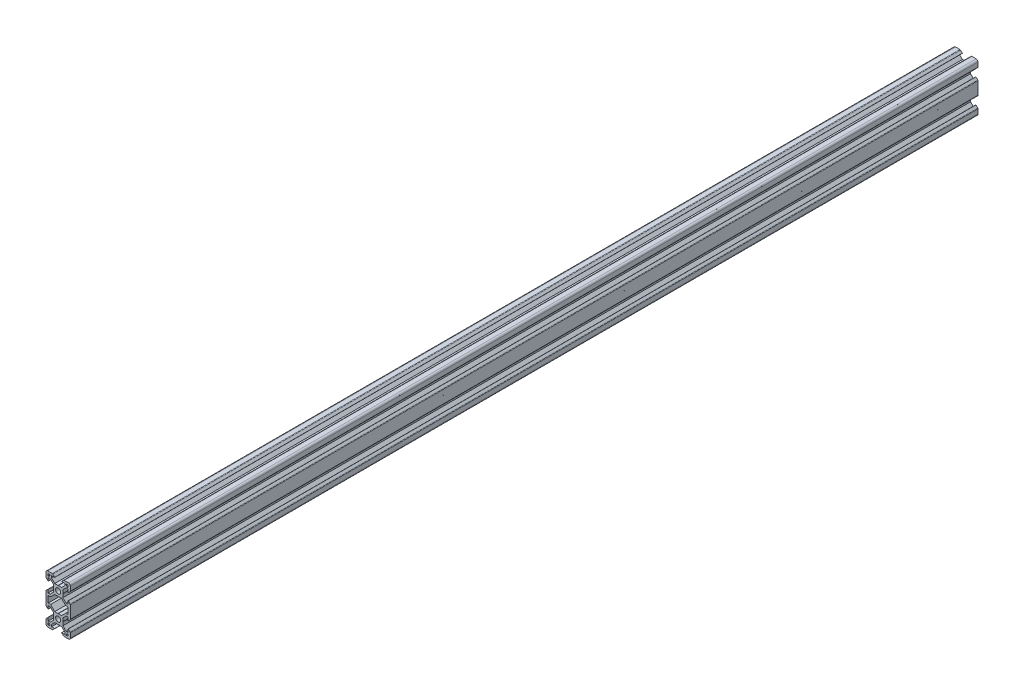
from build123d import *

# Parameters (mm, degrees)
SKETCH2_R           = 2.1
BOSS_EXTRUDE1_DEPTH = 746


with BuildPart() as part:
    # Sketch2 → Boss-Extrude1 (new body)
    with BuildSketch(Plane.XY):
        with BuildLine():
            Line((-0.1, 3.9), (0, 3.8))
            Line((0, 3.8), (0.1, 3.9))
            Line((0.1, 3.9), (2.840365134, 3.9))
            Line((2.840365134, 3.9), (5.5, 6.558825842))
            Line((5.5, 6.558825842), (5.5, 8.197505675))
            Line((5.5, 8.197505675), (2.89, 8.197505675))
            Line((2.89, 8.197505675), (2.89, 8.307505675))
            Line((2.89, 8.307505675), (4.348614357, 9.766120032))
            ThreePointArc((4.348614357, 9.766120032), (4.604908803, 9.937370505), (4.907228714, 9.997505675))
            Line((4.907228714, 9.997505675), (8.5, 9.997505675))
            ThreePointArc((8.5, 9.997505675), (9.560660172, 9.558165846), (10, 8.497505675))
            Line((10, 8.497505675), (10, 4.904734389))
            ThreePointArc((10, 4.904734389), (9.939864831, 4.602414477), (9.768614357, 4.346120032))
            Line((9.768614357, 4.346120032), (8.31, 2.887505675))
            Line((8.31, 2.887505675), (8.2, 2.887505675))
            Line((8.2, 2.887505675), (8.2, 5.497505675))
            Line((8.2, 5.497505675), (6.56, 5.497505675))
            Line((6.56, 5.497505675), (3.9, 2.83831481))
            Line((3.9, 2.83831481), (3.9, 0.1))
            Line((3.9, 0.1), (3.8, 0))
            Line((3.8, 0), (3.9, -0.1))
            Line((3.9, -0.1), (3.9, -2.84))
            Line((3.9, -2.84), (6.56, -5.5))
            Line((6.56, -5.5), (8.2, -5.5))
            Line((8.2, -5.5), (8.2, -2.89))
            Line((8.2, -2.89), (8.31, -2.89))
            Line((8.31, -2.89), (9.765685425, -4.345685425))
            ThreePointArc((9.765685425, -4.345685425), (9.939103626, -4.605224104), (10, -4.91137085))
            Line((10, -4.91137085), (10, -15.08862915))
            ThreePointArc((10, -15.08862915), (9.939103626, -15.394775896), (9.765685425, -15.654314575))
            Line((9.765685425, -15.654314575), (8.31, -17.11))
            Line((8.31, -17.11), (8.2, -17.11))
            Line((8.2, -17.11), (8.2, -14.5))
            Line((8.2, -14.5), (6.56, -14.5))
            Line((6.56, -14.5), (3.9, -17.16))
            Line((3.9, -17.16), (3.9, -19.9))
            Line((3.9, -19.9), (3.8, -20))
            Line((3.8, -20), (3.9, -20.1))
            Line((3.9, -20.1), (3.9, -22.83831481))
            Line((3.9, -22.83831481), (6.56, -25.497505675))
            Line((6.56, -25.497505675), (8.2, -25.497505675))
            Line((8.2, -25.497505675), (8.2, -22.887505675))
            Line((8.2, -22.887505675), (8.31, -22.887505675))
            Line((8.31, -22.887505675), (9.768614357, -24.346120032))
            ThreePointArc((9.768614357, -24.346120032), (9.939864831, -24.602414477), (10, -24.904734389))
            Line((10, -24.904734389), (10, -28.497505675))
            ThreePointArc((10, -28.497505675), (9.560660172, -29.558165846), (8.5, -29.997505675))
            Line((8.5, -29.997505675), (4.907228714, -29.997505675))
            ThreePointArc((4.907228714, -29.997505675), (4.604908803, -29.937370505), (4.348614357, -29.766120032))
            Line((4.348614357, -29.766120032), (2.89, -28.307505675))
            Line((2.89, -28.307505675), (2.89, -28.197505675))
            Line((2.89, -28.197505675), (5.5, -28.197505675))
            Line((5.5, -28.197505675), (5.5, -26.558825842))
            Line((5.5, -26.558825842), (2.840365134, -23.9))
            Line((2.840365134, -23.9), (0.1, -23.9))
            Line((0.1, -23.9), (0, -23.8))
            Line((0, -23.8), (-0.1, -23.9))
            Line((-0.1, -23.9), (-2.840365134, -23.9))
            Line((-2.840365134, -23.9), (-5.5, -26.558825842))
            Line((-5.5, -26.558825842), (-5.5, -28.197505675))
            Line((-5.5, -28.197505675), (-2.89, -28.197505675))
            Line((-2.89, -28.197505675), (-2.89, -28.307505675))
            Line((-2.89, -28.307505675), (-4.348614357, -29.766120032))
            ThreePointArc((-4.348614357, -29.766120032), (-4.604908803, -29.937370505), (-4.907228714, -29.997505675))
            Line((-4.907228714, -29.997505675), (-8.5, -29.997505675))
            ThreePointArc((-8.5, -29.997505675), (-9.560660172, -29.558165846), (-10, -28.497505675))
            Line((-10, -28.497505675), (-10, -24.904734389))
            ThreePointArc((-10, -24.904734389), (-9.939864831, -24.602414477), (-9.768614357, -24.346120032))
            Line((-9.768614357, -24.346120032), (-8.31, -22.887505675))
            Line((-8.31, -22.887505675), (-8.2, -22.887505675))
            Line((-8.2, -22.887505675), (-8.2, -25.497505675))
            Line((-8.2, -25.497505675), (-6.56, -25.497505675))
            Line((-6.56, -25.497505675), (-3.9, -22.83831481))
            Line((-3.9, -22.83831481), (-3.9, -20.1))
            Line((-3.9, -20.1), (-3.8, -20))
            Line((-3.8, -20), (-3.9, -19.9))
            Line((-3.9, -19.9), (-3.9, -17.16))
            Line((-3.9, -17.16), (-6.56, -14.5))
            Line((-6.56, -14.5), (-8.2, -14.5))
            Line((-8.2, -14.5), (-8.2, -17.11))
            Line((-8.2, -17.11), (-8.31, -17.11))
            Line((-8.31, -17.11), (-9.765685425, -15.654314575))
            ThreePointArc((-9.765685425, -15.654314575), (-9.939103626, -15.394775896), (-10, -15.08862915))
            Line((-10, -15.08862915), (-10, -4.91137085))
            ThreePointArc((-10, -4.91137085), (-9.939103626, -4.605224104), (-9.765685425, -4.345685425))
            Line((-9.765685425, -4.345685425), (-8.31, -2.89))
            Line((-8.31, -2.89), (-8.2, -2.89))
            Line((-8.2, -2.89), (-8.2, -5.5))
            Line((-8.2, -5.5), (-6.56, -5.5))
            Line((-6.56, -5.5), (-3.9, -2.84))
            Line((-3.9, -2.84), (-3.9, -0.1))
            Line((-3.9, -0.1), (-3.8, 0))
            Line((-3.8, 0), (-3.9, 0.1))
            Line((-3.9, 0.1), (-3.9, 2.83831481))
            Line((-3.9, 2.83831481), (-6.56, 5.497505675))
            Line((-6.56, 5.497505675), (-8.2, 5.497505675))
            Line((-8.2, 5.497505675), (-8.2, 2.887505675))
            Line((-8.2, 2.887505675), (-8.31, 2.887505675))
            Line((-8.31, 2.887505675), (-9.768614357, 4.346120032))
            ThreePointArc((-9.768614357, 4.346120032), (-9.939864831, 4.602414477), (-10, 4.904734389))
            Line((-10, 4.904734389), (-10, 8.497505675))
            ThreePointArc((-10, 8.497505675), (-9.560660172, 9.558165846), (-8.5, 9.997505675))
            Line((-8.5, 9.997505675), (-4.907228714, 9.997505675))
            ThreePointArc((-4.907228714, 9.997505675), (-4.604908803, 9.937370505), (-4.348614357, 9.766120032))
            Line((-4.348614357, 9.766120032), (-2.89, 8.307505675))
            Line((-2.89, 8.307505675), (-2.89, 8.197505675))
            Line((-2.89, 8.197505675), (-5.5, 8.197505675))
            Line((-5.5, 8.197505675), (-5.5, 6.558825842))
            Line((-5.5, 6.558825842), (-2.840365134, 3.9))
            Line((-2.840365134, 3.9), (-0.1, 3.9))
        make_face()
        Circle(SKETCH2_R, mode=Mode.SUBTRACT)
        with Locations(Location((0, -20, 0), (0, 0, 180))):
            Circle(SKETCH2_R, mode=Mode.SUBTRACT)
        Polygon((-7.66, 6.567505675), (-6.57, 7.657505675), (-6.57, 8.197505675), (-8.2, 8.197505675), (-8.2, 6.567505675), align=None, mode=Mode.SUBTRACT)
        Polygon((-0.1, -3.9), (0, -3.8), (0.1, -3.9), (2.840365134, -3.9), (6.24, -7.299634866), (8.2, -7.299634866), (8.2, -12.700365134), (6.24, -12.700365134), (2.840365134, -16.1), (0.1, -16.1), (0, -16.2), (-0.1, -16.1), (-2.840365134, -16.1), (-6.24, -12.700365134), (-8.2, -12.700365134), (-8.2, -7.299634866), (-6.24, -7.299634866), (-2.840365134, -3.9), align=None, mode=Mode.SUBTRACT)
        Polygon((8.2, 6.567505675), (7.66, 6.567505675), (6.57, 7.657505675), (6.57, 8.197505675), (8.2, 8.197505675), align=None, mode=Mode.SUBTRACT)
        Polygon((7.66, -26.567505675), (6.57, -27.657505675), (6.57, -28.197505675), (8.2, -28.197505675), (8.2, -26.567505675), align=None, mode=Mode.SUBTRACT)
        Polygon((-8.2, -26.567505675), (-7.66, -26.567505675), (-6.57, -27.657505675), (-6.57, -28.197505675), (-8.2, -28.197505675), align=None, mode=Mode.SUBTRACT)
    extrude(amount=-BOSS_EXTRUDE1_DEPTH)


solid = part.part
